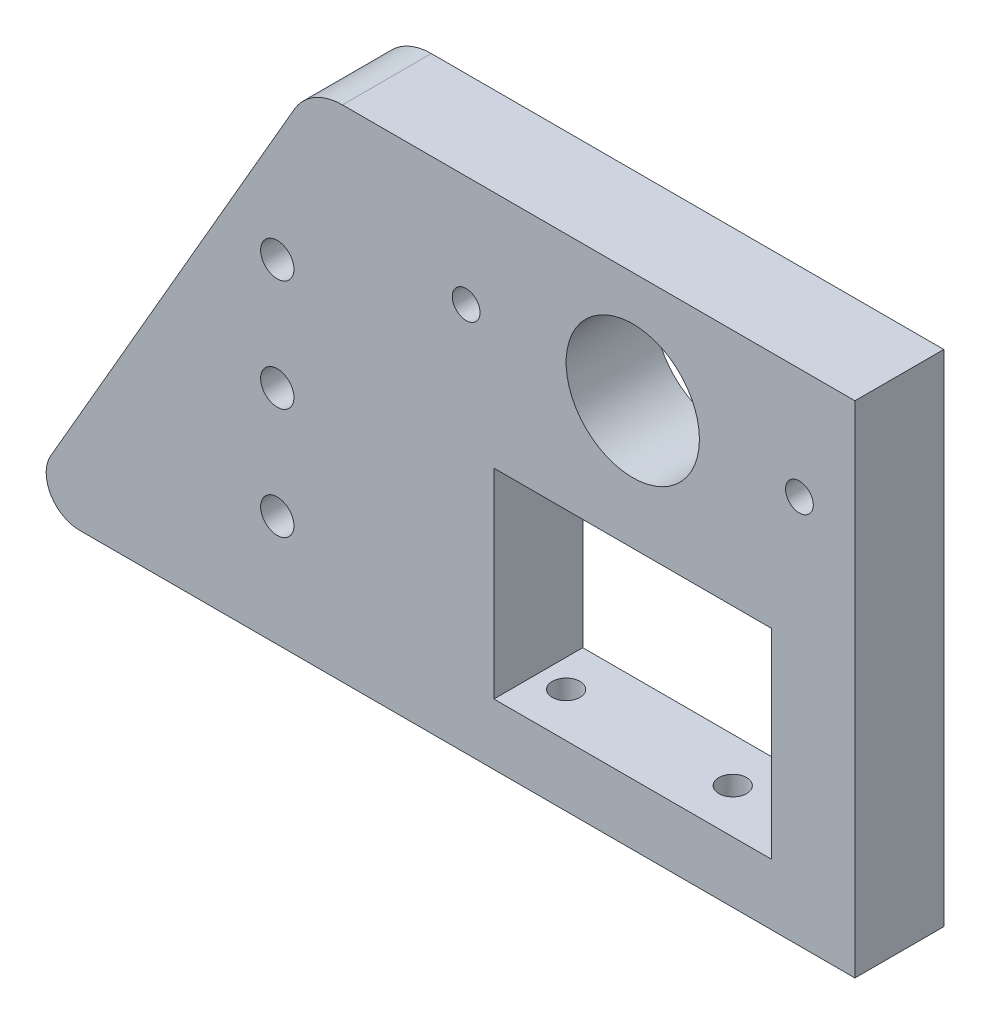
from build123d import *

# Parameters (mm, degrees)
SKETCH_1_R                   = 6
SKETCH_1_R_2                 = 1.5
SKETCH_1_W                   = 25
SKETCH_1_H                   = 18
EXTRUDE_1_DEPTH              = 8
HOLE_WIZARD_M3_1_D           = 2.5
HOLE_WIZARD_M3_1_DEPTH       = 6.748924226
HOLE_WIZARD_M3_1_CSINK_D     = 3.05
HOLE_WIZARD_M3_1_CSINK_ANGLE = 45
HOLE_WIZARD_M3_1_TIP         = 0.751075774
HOLE_WIZARD_M3_2_D           = 2.5
HOLE_WIZARD_M3_2_CSINK_D     = 3.05
HOLE_WIZARD_M3_2_CSINK_ANGLE = 45


with BuildPart() as part:
    # 草圖1 → 填料-伸長1 (new body)
    with BuildSketch(Plane.XY):
        with BuildLine():
            Line((-52.401923789, -30.5), (-30.462613559, 7.5))
            ThreePointArc((-30.462613559, 7.5), (-28.632486541, 9.330127019), (-26.132486541, 10))
            Line((-26.132486541, 10), (0, 10))
            Line((0, 10), (20, 10))
            Line((20, 10), (20, -35))
            Line((20, -35), (0, -35))
            Line((0, -35), (-49.803847577, -35))
            ThreePointArc((-49.803847577, -35), (-52.401923789, -33.5), (-52.401923789, -30.5))
        make_face()
        Circle(SKETCH_1_R, mode=Mode.SUBTRACT)
        with Locations((-32, -5)):
            Circle(SKETCH_1_R_2, mode=Mode.SUBTRACT)
        with Locations((-32, -15)):
            Circle(SKETCH_1_R_2, mode=Mode.SUBTRACT)
        with Locations((-32, -25)):
            Circle(SKETCH_1_R_2, mode=Mode.SUBTRACT)
        with Locations((0, -20.5)):
            Rectangle(SKETCH_1_W, SKETCH_1_H, mode=Mode.SUBTRACT)
    extrude(amount=EXTRUDE_1_DEPTH)

    # M3 螺紋孔1
    with Locations(Plane(origin=(-10, -35, 4), x_dir=(0, 0, -1), z_dir=(0, -1, 0))):
        with Locations((0, 0), (0, 15), (0, -15)):
            CounterSinkHole(HOLE_WIZARD_M3_1_D / 2, HOLE_WIZARD_M3_1_CSINK_D / 2, depth=HOLE_WIZARD_M3_1_DEPTH, counter_sink_angle=HOLE_WIZARD_M3_1_CSINK_ANGLE)
            with Locations((0, 0, -(HOLE_WIZARD_M3_1_DEPTH + HOLE_WIZARD_M3_1_TIP / 2))):  # 118° drill point
                Cone(0, HOLE_WIZARD_M3_1_D / 2, HOLE_WIZARD_M3_1_TIP, mode=Mode.SUBTRACT)

    # M3 螺紋孔2 (through all)
    with Locations(Plane(origin=(15, 0, 0), x_dir=(-1, 0, 0), z_dir=(0, 0, -1))):
        with Locations((0, 0), (30, 0)):
            CounterSinkHole(HOLE_WIZARD_M3_2_D / 2, HOLE_WIZARD_M3_2_CSINK_D / 2, counter_sink_angle=HOLE_WIZARD_M3_2_CSINK_ANGLE)


solid = part.part
